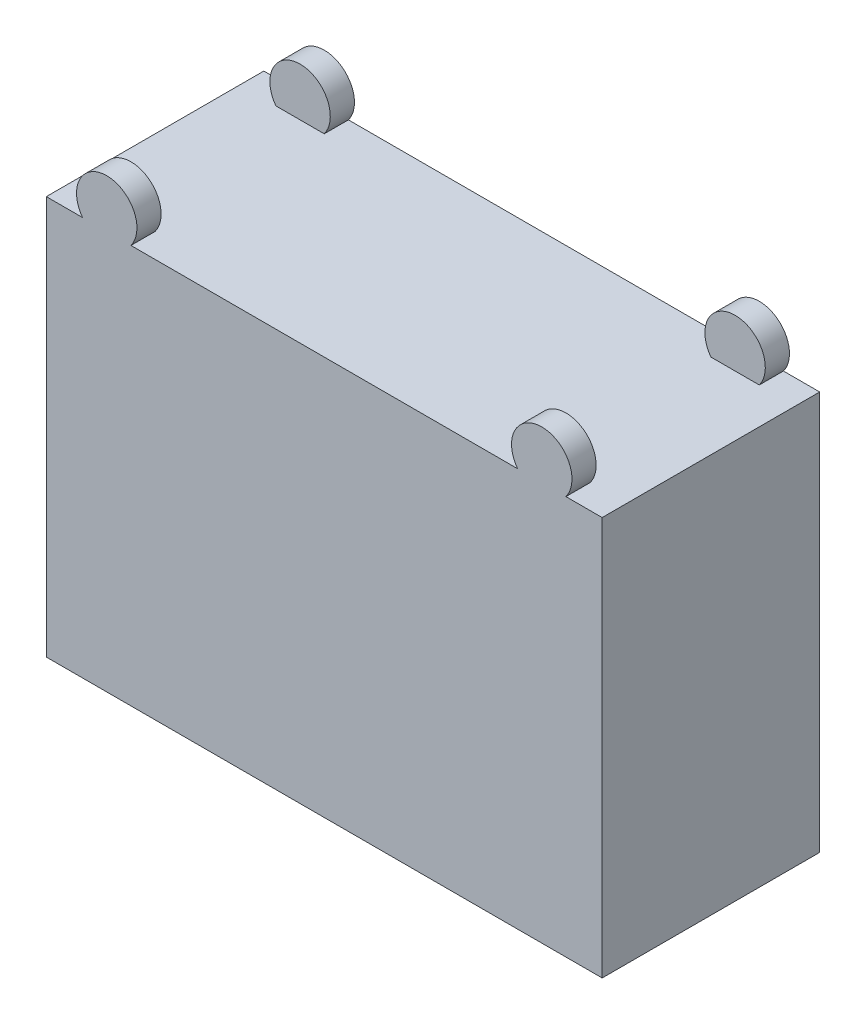
from build123d import *

# Parameters (mm, degrees)
SKETCH1_W           = 1168.4
SKETCH1_H           = 457.2
BOSS_EXTRUDE1_DEPTH = 838.2
SKETCH2_R           = 63.5
BOSS_EXTRUDE2_DEPTH = 50.8


with BuildPart() as part:
    # Sketch1 → Boss-Extrude1 (new body)
    with BuildSketch(Plane(origin=(0, 0, 0), x_dir=(1, 0, 0), z_dir=(0, 1, 0))):
        Rectangle(SKETCH1_W, SKETCH1_H)
    extrude(amount=BOSS_EXTRUDE1_DEPTH)

    # Sketch2 → Boss-Extrude2 (add)
    with BuildSketch(Plane.XY.offset(228.6)):
        with Locations((-457.2, 876.3)):
            Circle(SKETCH2_R)
        with Locations((457.2, 876.3)):
            Circle(SKETCH2_R)
    boss_extrude2 = extrude(amount=-BOSS_EXTRUDE2_DEPTH)

    # Mirror1: Boss-Extrude2 across plane
    add(boss_extrude2.mirror(Plane.XY))


solid = part.part
